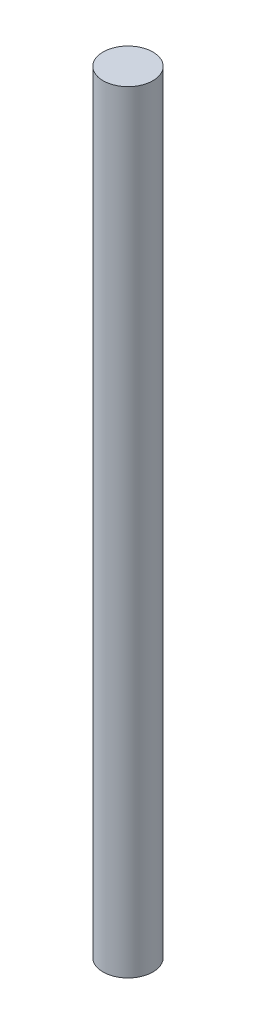
from build123d import *

# Parameters (mm, degrees)
ESQUISSE1_R        = 2
BOSS_EXTRU_1_DEPTH = 62


with BuildPart() as part:
    # Esquisse1 → Boss.-Extru.1 (new body)
    with BuildSketch(Plane(origin=(0, 0, 0), x_dir=(1, 0, 0), z_dir=(0, 1, 0))):
        with Locations(Location((0, 0, 0), (0, 0, 270))):
            Circle(ESQUISSE1_R)
    extrude(amount=BOSS_EXTRU_1_DEPTH)


solid = part.part
